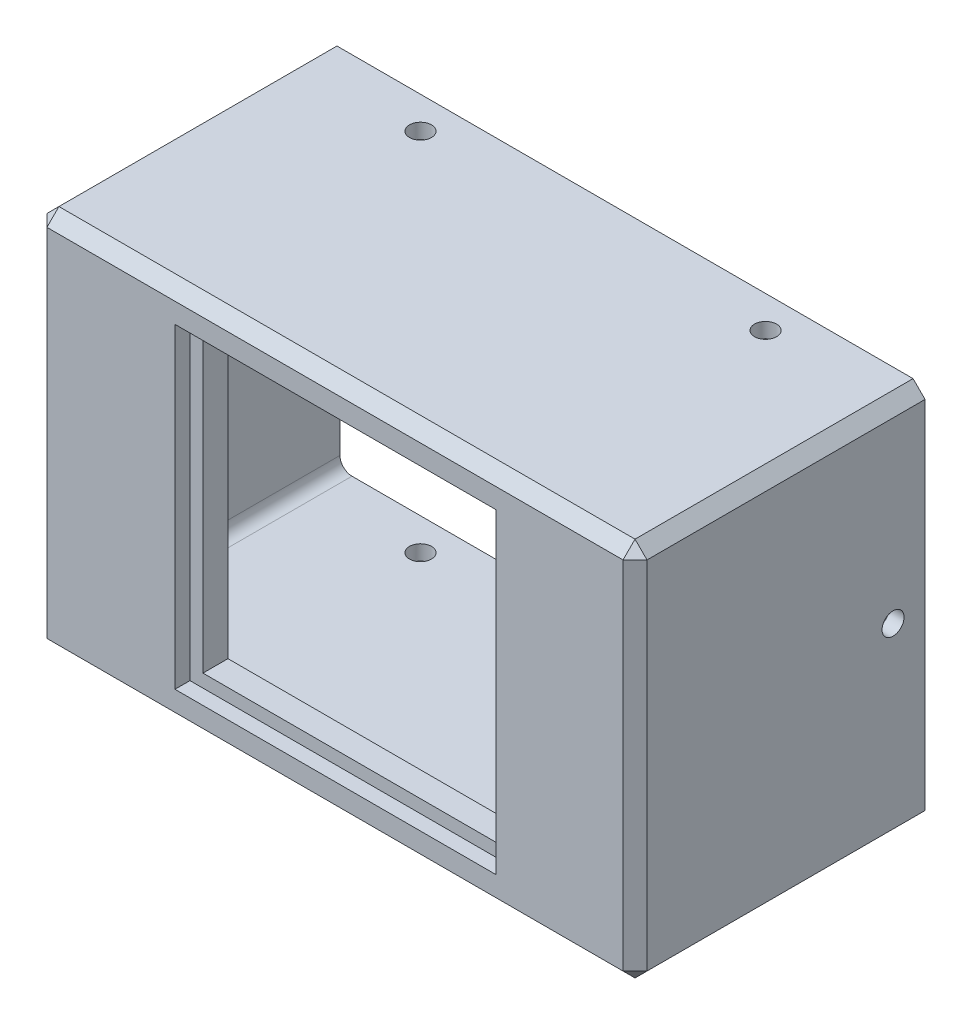
from build123d import *

# Parameters (mm, degrees)
ESQUISSE1_W                     = 60
ESQUISSE1_H                     = 38
BASE_DEPTH                      = 4
ESQUISSE2_W                     = 29.5
ESQUISSE2_H                     = 29
SCREEN_DEPTH                    = 4
ESQUISSE5_R                     = 2.1
INSERTS_M3_DEPTH                = 3
ESQUISSE6_W                     = 60
ESQUISSE6_H                     = 38
ESQUISSE6_W_2                   = 57
ESQUISSE6_H_2                   = 35
WALLS_DEPTH                     = 25
CHANFREIN_EXT_SIZE              = 1.2
FILLET_INT_R                    = 1.2
ESQUISSE7_R                     = 1.1
PASSAGE_VIS_HORIZONTAL_DEPTH    = 68.720011813
ESQUISSE9_R                     = 1.1
PASSAGE_VIS_VERTICAL_DEPTH      = 55.488530903
ESQUISSE11_W                    = 32.1
ESQUISSE11_H                    = 31.6
EMPLACEMENT_VERRE_32_5_32_DEPTH = 1.5


with BuildPart() as part:
    # Esquisse1 → BASE (new body)
    with BuildSketch(Plane.XY):
        Rectangle(ESQUISSE1_W, ESQUISSE1_H)
    extrude(amount=BASE_DEPTH)

    # Esquisse2 → Screen (cut)
    with BuildSketch(Plane.XY.offset(4)):
        with Locations((0.05, 0)):
            Rectangle(ESQUISSE2_W, ESQUISSE2_H)
    extrude(amount=-SCREEN_DEPTH, mode=Mode.SUBTRACT)

    # Esquisse5 → Inserts_M3 (cut)
    with BuildSketch(Plane(origin=(0, 0, 0), x_dir=(-1, 0, 0), z_dir=(0, 0, -1))):
        with Locations((-24.3, 14)):
            Circle(ESQUISSE5_R)
        with Locations(Location((-24.3, -14, 0), (0, 0, 180))):
            Circle(ESQUISSE5_R)
        with Locations((18.6, -14)):
            Circle(ESQUISSE5_R)
        with Locations(Location((18.6, 14, 0), (0, 0, 180))):
            Circle(ESQUISSE5_R)
    extrude(amount=-INSERTS_M3_DEPTH, mode=Mode.SUBTRACT)

    # Esquisse6 → Walls (add)
    with BuildSketch(Plane(origin=(0, 0, 0), x_dir=(-1, 0, 0), z_dir=(0, 0, -1))):
        Rectangle(ESQUISSE6_W, ESQUISSE6_H)
        Rectangle(ESQUISSE6_W_2, ESQUISSE6_H_2, mode=Mode.SUBTRACT)
    extrude(amount=WALLS_DEPTH)

    # Chanfrein_EXT
    chanfrein_ext_edges = [part.edges().sort_by_distance(p)[0] for p in [
        (30, 0, 4),
        (0, 19, 4),
        (-30, 0, 4),
        (-30, 19, -10.5),
        (30, 19, -10.5),
        (30, -19, -10.5),
        (-30, -19, -10.5),
        (0, -19, 4),
    ]]
    chamfer(chanfrein_ext_edges, length=CHANFREIN_EXT_SIZE)

    # Fillet_INT
    fillet_int_edges = [part.edges().sort_by_distance(p)[0] for p in [
        (0, 17.5, 0),
        (28.5, 0, 0),
        (0, -17.5, 0),
        (-28.5, 0, 0),
        (28.5, 17.5, -12.5),
        (28.5, -17.5, -12.5),
        (-28.5, -17.5, -12.5),
        (-28.5, 17.5, -12.5),
    ]]
    fillet(fillet_int_edges, radius=FILLET_INT_R)

    # Esquisse7 → Passage_Vis_Horizontal (cut, through all)
    with BuildSketch(Plane(origin=(30, 0, 0), x_dir=(0, 0, -1), z_dir=(1, 0, 0))):
        with Locations(Location((21.8, 0, 0), (0, 0, 90))):
            Circle(ESQUISSE7_R)
    extrude(amount=-PASSAGE_VIS_HORIZONTAL_DEPTH, mode=Mode.SUBTRACT)

    # Esquisse9 → Passage_Vis_Vertical (cut, through all)
    with BuildSketch(Plane(origin=(0, 19, 0), x_dir=(1, 0, 0), z_dir=(0, 1, 0))):
        with Locations(Location((-17.25, 21.8, 0), (0, 0, 180))):
            Circle(ESQUISSE9_R)
        with Locations(Location((17.25, 21.8, 0), (0, 0, 180))):
            Circle(ESQUISSE9_R)
    extrude(amount=-PASSAGE_VIS_VERTICAL_DEPTH, mode=Mode.SUBTRACT)

    # Esquisse11 → Emplacement Verre 32.5*32 (cut)
    with BuildSketch(Plane.XY.offset(4)):
        with Locations((0.05, 0)):
            Rectangle(ESQUISSE11_W, ESQUISSE11_H)
    extrude(amount=-EMPLACEMENT_VERRE_32_5_32_DEPTH, mode=Mode.SUBTRACT)


solid = part.part
